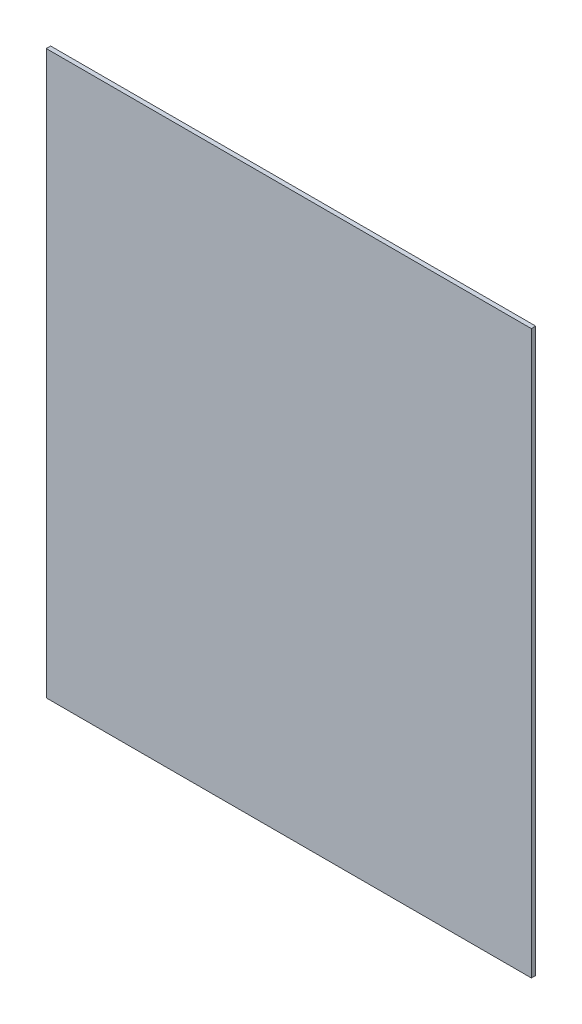
from build123d import *

# Parameters (mm, degrees)
ESQUISSE1_W        = 722
ESQUISSE1_H        = 837
BOSS_EXTRU_1_DEPTH = 6.5


with BuildPart() as part:
    # Esquisse1 → Boss.-Extru.1 (new body)
    with BuildSketch(Plane.XY):
        Rectangle(ESQUISSE1_W, ESQUISSE1_H)
    extrude(amount=BOSS_EXTRU_1_DEPTH)


solid = part.part
